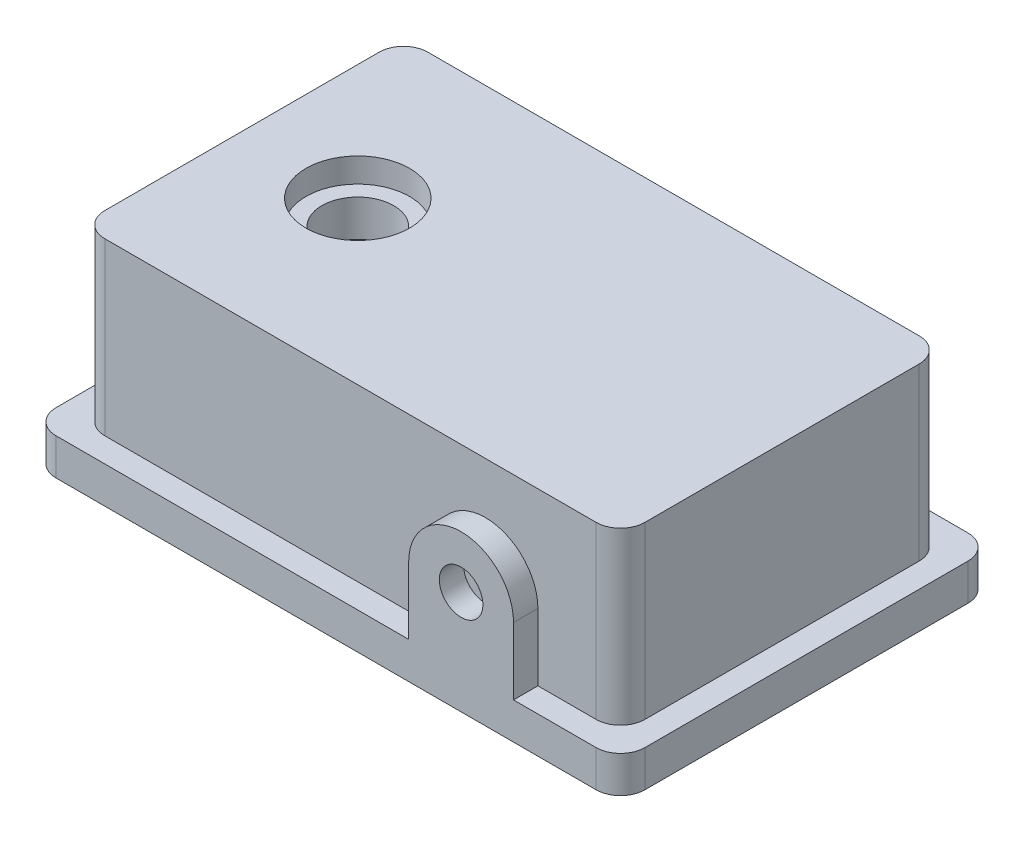
from build123d import *

# Parameters (mm, degrees)
SKETCH_1_W          = 483
SKETCH_1_H          = 305
EXTRUDE_1_DEPTH     = 30
SKETCH_2_W          = 443
SKETCH_2_H          = 265
EXTRUDE_2_DEPTH     = 140
FILLET_2_R          = 20
CUT_EXTRUDE_START   = -20
CUT_EXTRUDE_3_DEPTH = 576.998322145
SKETCH_7_R          = 42.5
SKETCH_7_R_2        = 29.5
EXTRUDE_3_DEPTH     = 50
SKETCH_7_5_R        = 42.5
SKETCH_7_5_R_2      = 29.5
CUT_EXTRUDE_5_DEPTH = 20
SKETCH_7_6_R        = 29.5
CUT_EXTRUDE_6_DEPTH = 40
SKETCH_9_R          = 17.8766886
EXTRUDE_4_DEPTH     = 20


with BuildPart() as part:
    # 草图1 → 凸台-拉伸1 (new body)
    with BuildSketch(Plane(origin=(0, 0, 0), x_dir=(1, 0, 0), z_dir=(0, 1, 0))):
        with Locations((-241.5, 152.5)):
            Rectangle(SKETCH_1_W, SKETCH_1_H)
    extrude(amount=EXTRUDE_1_DEPTH)

    # 草图2 → 凸台-拉伸2 (add)
    with BuildSketch(Plane(origin=(0, 30, 0), x_dir=(1, 0, 0), z_dir=(0, 1, 0))):
        with Locations((-241.5, 152.5)):
            Rectangle(SKETCH_2_W, SKETCH_2_H)
    extrude(amount=EXTRUDE_2_DEPTH)

    # 圆角2
    fillet_2_edges = [part.edges().sort_by_distance(p)[0] for p in [
        (-463, 100, -285),
        (-463, 100, -20),
        (-20, 100, -20),
        (-20, 100, -285),
        (0, 15, 0),
        (-483, 15, 0),
        (-483, 15, -305),
        (0, 15, -305),
    ]]
    fillet(fillet_2_edges, radius=FILLET_2_R)

    # 草图5 → 切除-拉伸3 (cut, through all)
    with BuildSketch(Plane(origin=(0, 170, 0), x_dir=(1, 0, 0), z_dir=(0, 1, 0)).offset(CUT_EXTRUDE_START)):
        with BuildLine():
            Line((-40, 60), (-40, 245))
            ThreePointArc((-40, 245), (-45.857864376, 259.142135624), (-60, 265))
            Line((-60, 265), (-423, 265))
            ThreePointArc((-423, 265), (-437.142135624, 259.142135624), (-443, 245))
            Line((-443, 245), (-443, 60))
            ThreePointArc((-443, 60), (-437.142135624, 45.857864376), (-423, 40))
            Line((-423, 40), (-60, 40))
            ThreePointArc((-60, 40), (-45.857864376, 45.857864376), (-40, 60))
        make_face()
    extrude(amount=-CUT_EXTRUDE_3_DEPTH, mode=Mode.SUBTRACT)

    # 草图7 → 凸台-拉伸3 (add)
    # profile 1 of 2: a face of its own
    with BuildSketch(Plane(origin=(0, 170, 0), x_dir=(1, 0, 0), z_dir=(0, 1, 0))):
        with BuildLine():
            Line((-368, 207.5), (-463, 207.5))
            Line((-463, 207.5), (-463, 97.5))
            Line((-463, 97.5), (-368, 97.5))
            ThreePointArc((-368, 97.5), (-313, 152.5), (-368, 207.5))
        make_face()
        with Locations((-368, 152.5)):
            Circle(SKETCH_7_R, mode=Mode.SUBTRACT)
    # profile 2 of 2: a face of its own
    with BuildSketch(Plane(origin=(0, 170, 0), x_dir=(1, 0, 0), z_dir=(0, 1, 0))):
        with Locations((-368, 152.5)):
            Circle(SKETCH_7_R)
        with Locations(Location((-368, 152.5, 0), (0, 0, 270))):
            Circle(SKETCH_7_R_2, mode=Mode.SUBTRACT)
    extrude(amount=-EXTRUDE_3_DEPTH)

    # 草图7<5> → 切除-拉伸5 (cut)
    with BuildSketch(Plane(origin=(0, 170, 0), x_dir=(1, 0, 0), z_dir=(0, 1, 0))):
        with Locations(Location((-368, 152.5, 0), (0, 0, 270))):
            Circle(SKETCH_7_5_R)
        with Locations(Location((-368, 152.5, 0), (0, 0, 270))):
            Circle(SKETCH_7_5_R_2, mode=Mode.SUBTRACT)
    extrude(amount=-CUT_EXTRUDE_5_DEPTH, mode=Mode.SUBTRACT)


with BuildPart() as cut_extrude_5_piece_1:
    # of the separate pieces the step leaves, piece 1, a body of its own (cut_extrude_5_pieces)
    add(part.part.solids().sort_by_distance((-20, 0, 0))[0])

    # 草图9 → 凸台-拉伸4 (add)
    with BuildSketch(Plane.XY.offset(-20)):
        with BuildLine():
            Line((-87.75, 30), (-87.75, 85))
            ThreePointArc((-87.75, 85), (-130.75, 128), (-173.75, 85))
            Line((-173.75, 85), (-173.75, 30))
            Line((-173.75, 30), (-87.75, 30))
        make_face()
        with Locations(Location((-130.75, 85, 0), (0, 0, 180))):
            Circle(SKETCH_9_R, mode=Mode.SUBTRACT)
    extrude(amount=EXTRUDE_4_DEPTH)


with BuildPart() as cut_extrude_5_piece_2:
    # of the separate pieces the step leaves, piece 2, a body of its own (cut_extrude_5_pieces)
    add(part.part.solids().sort_by_distance((-368, 170, -123))[0])

    # 草图7<6> → 切除-拉伸6 (cut)
    with BuildSketch(Plane(origin=(0, 170, 0), x_dir=(1, 0, 0), z_dir=(0, 1, 0))):
        with Locations(Location((-368, 152.5, 0), (0, 0, 270))):
            Circle(SKETCH_7_6_R)
    extrude(amount=-CUT_EXTRUDE_6_DEPTH, mode=Mode.SUBTRACT)


solid = cut_extrude_5_piece_1.part
